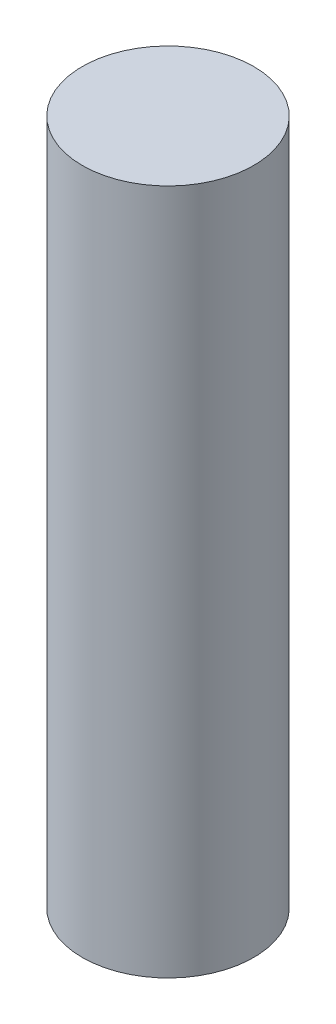
from build123d import *

# Parameters (mm, degrees)
CROQUIS1_R              = 3.75
SALIENTE_EXTRUIR1_DEPTH = 30


with BuildPart() as part:
    # Croquis1 → Saliente-Extruir1 (new body)
    with BuildSketch(Plane(origin=(0, 0, 0), x_dir=(1, 0, 0), z_dir=(0, 1, 0))):
        with Locations(Location((0, 0, 0), (0, 0, 270))):
            Circle(CROQUIS1_R)
    extrude(amount=SALIENTE_EXTRUIR1_DEPTH)


solid = part.part
